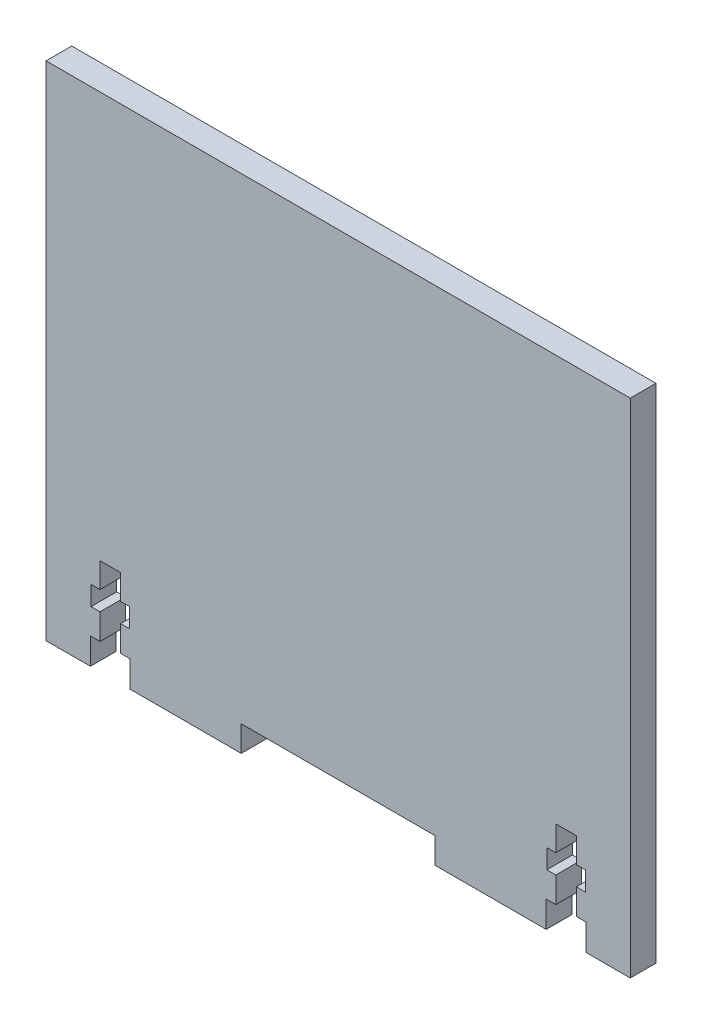
from build123d import *

# Parameters (mm, degrees)
SKETCH1_W           = 91
SKETCH1_H           = 78.23
BOSS_EXTRUDE1_DEPTH = 4
CUT_EXTRUDE2_DEPTH  = 61.135124719
SKETCH3_W           = 30.2
SKETCH3_H           = 4
CUT_EXTRUDE3_DEPTH  = 4


with BuildPart() as part:
    # Sketch1 → Boss-Extrude1 (new body)
    with BuildSketch(Plane.XY):
        Rectangle(SKETCH1_W, SKETCH1_H)
    extrude(amount=BOSS_EXTRUDE1_DEPTH)

    # Sketch2 → Cut-Extrude2 (cut, through all)
    with BuildSketch(Plane.XY.offset(4)):
        Polygon((38.6, -39.115), (38.6, -35.015), (37.1, -35.015), (37.1, -31.015), (38.5, -31.015), (38.5, -28.015), (37.1, -28.015), (37.1, -24.115), (33.9, -24.115), (33.9, -28.015), (32.5, -28.015), (32.5, -31.015), (33.9, -31.015), (33.9, -35.015), (32.4, -35.015), (32.4, -39.115), align=None)
        Polygon((-32.4, -39.115), (-38.6, -39.115), (-38.6, -35.015), (-37.1, -35.015), (-37.1, -31.015), (-38.5, -31.015), (-38.5, -28.015), (-37.1, -28.015), (-37.1, -24.115), (-33.9, -24.115), (-33.9, -28.015), (-32.5, -28.015), (-32.5, -31.015), (-33.9, -31.015), (-33.9, -35.015), (-32.4, -35.015), align=None)
    extrude(amount=-CUT_EXTRUDE2_DEPTH, mode=Mode.SUBTRACT)

    # Sketch3 → Cut-Extrude3 (cut)
    with BuildSketch(Plane.XY.offset(4)):
        with Locations((0, -37.115)):
            Rectangle(SKETCH3_W, SKETCH3_H)
    extrude(amount=-CUT_EXTRUDE3_DEPTH, mode=Mode.SUBTRACT)


solid = part.part
